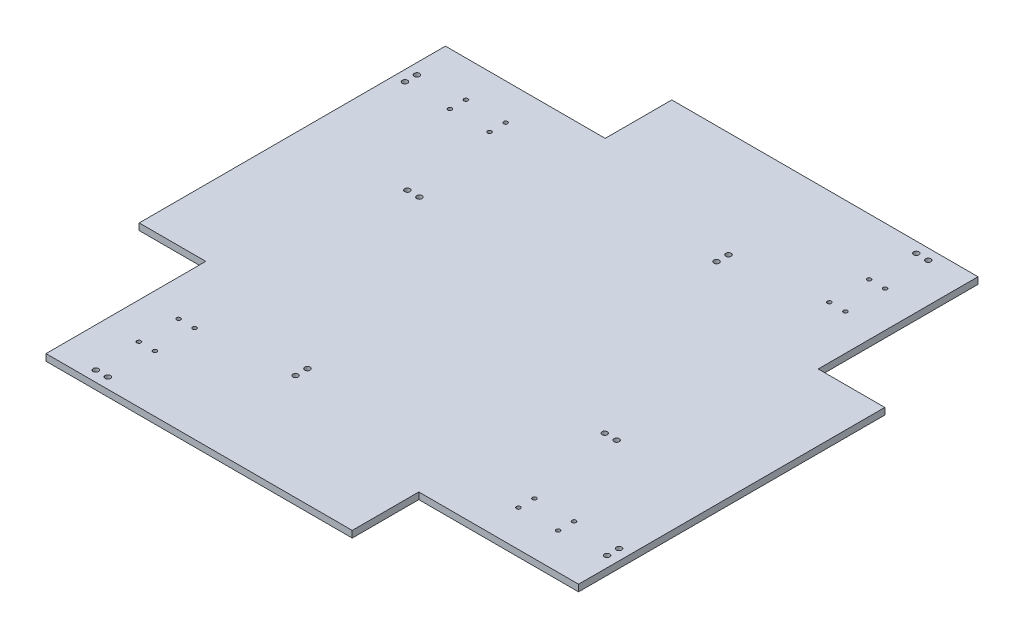
from build123d import *

# Parameters (mm, degrees)
SKETCH1_W           = 400
SKETCH1_H           = 400
BOSS_EXTRUDE1_DEPTH = 5
SKETCH2_W           = 120
SKETCH2_H           = 50
SKETCH2_W_2         = 50
SKETCH2_H_2         = 120
CUT_EXTRUDE1_DEPTH  = 5
SKETCH4_R           = 2
SKETCH4_R_2         = 1.5
CUT_EXTRUDE2_DEPTH  = 5


with BuildPart() as part:
    # Sketch1 → Boss-Extrude1 (new body)
    with BuildSketch(Plane(origin=(0, 0, 0), x_dir=(1, 0, 0), z_dir=(0, 1, 0))):
        with Locations((163.492063492, -170.952380952)):
            Rectangle(SKETCH1_W, SKETCH1_H)
    extrude(amount=BOSS_EXTRUDE1_DEPTH)

    # Sketch2 → Cut-Extrude1 (cut)
    with BuildSketch(Plane(origin=(0, 5, 0), x_dir=(1, 0, 0), z_dir=(0, 1, 0))):
        with Locations((23.492063492, 4.047619048)):
            Rectangle(SKETCH2_W, SKETCH2_H)
        with Locations((338.492063492, -30.952380952)):
            Rectangle(SKETCH2_W_2, SKETCH2_H_2)
        with Locations((303.492063492, -345.952380952)):
            Rectangle(SKETCH2_W, SKETCH2_H)
        with Locations((-11.507936508, -310.952380952)):
            Rectangle(SKETCH2_W_2, SKETCH2_H_2)
    extrude(amount=-CUT_EXTRUDE1_DEPTH, mode=Mode.SUBTRACT)

    # Sketch4 → Cut-Extrude2 (cut)
    with BuildSketch(Plane(origin=(0, 5, 0), x_dir=(1, 0, 0), z_dir=(0, 1, 0))):
        with Locations(Location((284.092063492, -212.952380952, 0), (0, 0, 270))):
            Circle(SKETCH4_R)
        with Locations(Location((275.092063492, -212.952380952, 0), (0, 0, 270))):
            Circle(SKETCH4_R)
        with Locations(Location((284.092063492, 21.047619048, 0), (0, 0, 270))):
            Circle(SKETCH4_R)
        with Locations(Location((275.092063492, 21.047619048, 0), (0, 0, 270))):
            Circle(SKETCH4_R)
        with Locations(Location((286.292063492, -13.552380952, 0), (0, 0, 270))):
            Circle(SKETCH4_R_2)
        with Locations(Location((274.292063492, -13.552380952, 0), (0, 0, 270))):
            Circle(SKETCH4_R_2)
        with Locations(Location((286.292063492, -43.352380952, 0), (0, 0, 270))):
            Circle(SKETCH4_R_2)
        with Locations(Location((274.292063492, -43.352380952, 0), (0, 0, 270))):
            Circle(SKETCH4_R_2)
        with Locations(Location((355.492063492, -291.552380952, 0), (0, 0, 270))):
            Circle(SKETCH4_R)
        with Locations(Location((355.492063492, -282.552380952, 0), (0, 0, 270))):
            Circle(SKETCH4_R)
        with Locations(Location((320.892063492, -293.752380952, 0), (0, 0, 270))):
            Circle(SKETCH4_R_2)
        with Locations(Location((320.892063492, -281.752380952, 0), (0, 0, 270))):
            Circle(SKETCH4_R_2)
        with Locations(Location((291.092063492, -293.752380952, 0), (0, 0, 270))):
            Circle(SKETCH4_R_2)
        with Locations(Location((291.092063492, -281.752380952, 0), (0, 0, 270))):
            Circle(SKETCH4_R_2)
        with Locations(Location((121.492063492, -291.552380952, 0), (0, 0, 270))):
            Circle(SKETCH4_R)
        with Locations(Location((121.492063492, -282.552380952, 0), (0, 0, 270))):
            Circle(SKETCH4_R)
        with Locations(Location((51.892063492, -362.952380952, 0), (0, 0, 270))):
            Circle(SKETCH4_R)
        with Locations(Location((42.892063492, -362.952380952, 0), (0, 0, 270))):
            Circle(SKETCH4_R)
        with Locations(Location((52.692063492, -328.352380952, 0), (0, 0, 270))):
            Circle(SKETCH4_R_2)
        with Locations(Location((40.692063492, -328.352380952, 0), (0, 0, 270))):
            Circle(SKETCH4_R_2)
        with Locations(Location((52.692063492, -298.552380952, 0), (0, 0, 270))):
            Circle(SKETCH4_R_2)
        with Locations(Location((40.692063492, -298.552380952, 0), (0, 0, 270))):
            Circle(SKETCH4_R_2)
        with Locations(Location((51.892063492, -128.952380952, 0), (0, 0, 270))):
            Circle(SKETCH4_R)
        with Locations(Location((42.892063492, -128.952380952, 0), (0, 0, 270))):
            Circle(SKETCH4_R)
        with Locations(Location((-28.507936508, -59.352380952, 0), (0, 0, 270))):
            Circle(SKETCH4_R)
        with Locations(Location((-28.507936508, -50.352380952, 0), (0, 0, 270))):
            Circle(SKETCH4_R)
        with Locations(Location((35.892063492, -60.152380952, 0), (0, 0, 270))):
            Circle(SKETCH4_R_2)
        with Locations(Location((35.892063492, -48.152380952, 0), (0, 0, 270))):
            Circle(SKETCH4_R_2)
        with Locations(Location((6.092063492, -60.152380952, 0), (0, 0, 270))):
            Circle(SKETCH4_R_2)
        with Locations(Location((6.092063492, -48.152380952, 0), (0, 0, 270))):
            Circle(SKETCH4_R_2)
        with Locations(Location((205.492063492, -59.352380952, 0), (0, 0, 270))):
            Circle(SKETCH4_R)
        with Locations(Location((205.492063492, -50.352380952, 0), (0, 0, 270))):
            Circle(SKETCH4_R)
    extrude(amount=-CUT_EXTRUDE2_DEPTH, mode=Mode.SUBTRACT)


solid = part.part
